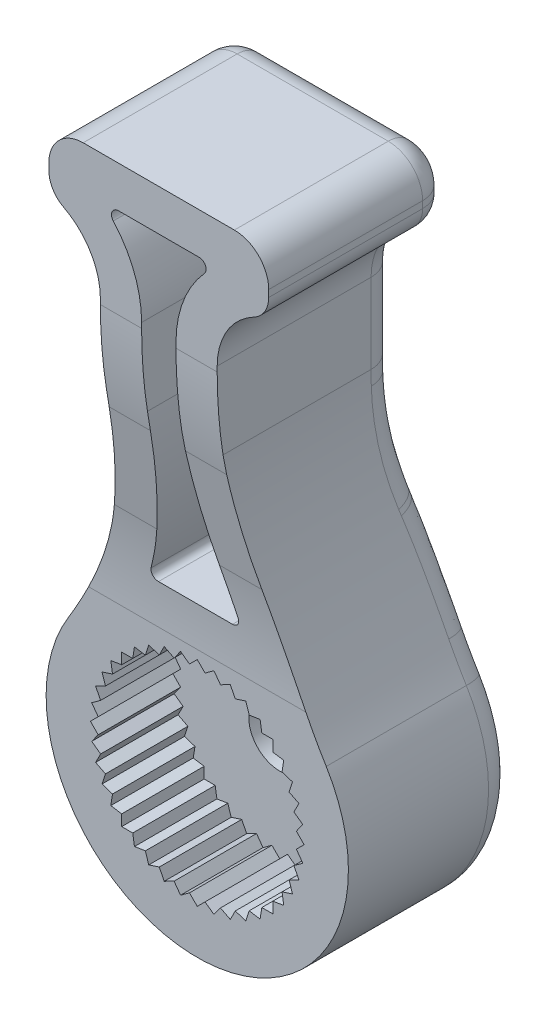
from build123d import *

# Parameters (mm, degrees)
BOSS_EXTRU_1_DEPTH                             = 15
ENL_V_MAT_EXTRU_1_DEPTH                        = 12.5
CONG_1_R                                       = 2
ENL_V_MAT_EXTRU_2_DEPTH                        = 6
ENL_V_MAT_EXTRU_3_DEPTH                        = 9.5
FRAISAGE_POUR_VIS_T_TE_FRAIS_E_M41_D           = 4.5
FRAISAGE_POUR_VIS_T_TE_FRAIS_E_M41_CSINK_D     = 7.4
FRAISAGE_POUR_VIS_T_TE_FRAIS_E_M41_CSINK_ANGLE = 90


with BuildPart() as part:
    # Esquisse1 → Boss.-Extru.1 (new body)
    with BuildSketch(Plane.XY):
        with BuildLine():
            Line((-5.5, 39), (5.5, 39))
            ThreePointArc((5.5, 39), (7.267766953, 38.267766953), (8, 36.5))
            Line((8, 36.5), (8, 36))
            ThreePointArc((8, 36), (7.711306936, 34.964901661), (6.928571429, 34.228629033))
            ThreePointArc((6.928571429, 34.228629033), (4.97173266, 32.387947464), (4.25, 29.800201616))
            Line((4.25, 29.800201616), (4.25, 23.988278388))
            ThreePointArc((4.25, 23.988278388), (5.55842416, 14.507892457), (9.385869565, 5.736327441))
            ThreePointArc((9.385869565, 5.736327441), (0, -11), (-9.385869565, 5.736327441))
            ThreePointArc((-9.385869565, 5.736327441), (-5.55842416, 14.507892457), (-4.25, 23.988278388))
            Line((-4.25, 23.988278388), (-4.25, 29.800201616))
            ThreePointArc((-4.25, 29.800201616), (-4.97173266, 32.387947464), (-6.928571429, 34.228629033))
            ThreePointArc((-6.928571429, 34.228629033), (-7.711306936, 34.964901661), (-8, 36))
            Line((-8, 36), (-8, 36.5))
            ThreePointArc((-8, 36.5), (-7.267766953, 38.267766953), (-5.5, 39))
        make_face()
    extrude(amount=BOSS_EXTRU_1_DEPTH)

    # Esquisse2 → Enlèv. mat.-Extru.1 (cut, symmetric)
    with BuildSketch(Plane(origin=(0, 0, 0), x_dir=(0, 0, -1), z_dir=(1, 0, 0))):
        with BuildLine():
            Line((-1.8, 39), (-1.8, 22.888888889))
            ThreePointArc((-1.8, 22.888888889), (-1.585930714, 19.023785476), (-0.946341463, 15.20596206))
            Line((-0.946341463, 15.20596206), (-0.853658537, 14.79403794))
            ThreePointArc((-0.853658537, 14.79403794), (-0.214069286, 10.976214524), (0, 7.111111111))
            Line((0, 7.111111111), (0, 5.736327441))
            Line((0, 5.736327441), (7.239623286, 8.413390474))
            Line((7.239623286, 8.413390474), (7.239623286, 39))
            Line((7.239623286, 39), (0, 39))
            Line((0, 39), (-1.8, 39))
        make_face()
        with BuildLine():
            Line((-12.2, -12.159132982), (-12.2, 8.413390474))
            ThreePointArc((-12.2, 8.413390474), (-12.366625309, 11.824549752), (-12.864914721, 15.203229859))
            Line((-12.864914721, 15.203229859), (-14.335085279, 22.637637159))
            ThreePointArc((-14.335085279, 22.637637159), (-14.833374691, 26.016317267), (-15, 29.427476544))
            Line((-15, 29.427476544), (-15, 29.800201616))
            Line((-15, 29.800201616), (-17.016089538, 29.800201616))
            Line((-17.016089538, 29.800201616), (-17.016089538, -12.159132982))
            Line((-17.016089538, -12.159132982), (-12.2, -12.159132982))
        make_face()
    extrude(amount=ENL_V_MAT_EXTRU_1_DEPTH, both=True, mode=Mode.SUBTRACT)

    # Congé1
    cong_1_edges = [part.edges().sort_by_distance(p)[0] for p in [
        (0, -11, 0),
        (8.979104822, 6.419188908, 0),
        (-8.979104822, 6.419188908, 0),
        (-4.254317965, 23.438515814, 1.8),
        (-4.608140366, 18.994125554, 1.582622356),
        (-5.423856389, 14.999840903, 0.899964203),
        (5.423856389, 14.999840903, 0.899964203),
        (4.608140366, 18.994125554, 1.582622355),
        (4.254317965, 23.438515814, 1.8),
        (4.25, 26.894240002, 1.8),
        (4.97173266, 32.387947464, 1.8),
        (7.711306936, 34.964901661, 1.8),
        (8, 36.25, 1.8),
        (7.267766953, 38.267766953, 1.8),
        (-7.267766953, 38.267766953, 1.8),
        (-8, 36.25, 1.8),
        (-7.711306936, 34.964901661, 1.8),
        (-4.97173266, 32.387947464, 1.8),
        (-4.25, 26.894240002, 1.8),
        (6.796676556, 10.881722866, 0.203700094),
        (-6.796676556, 10.881722866, 0.203700094),
        (0, 39, 1.8),
    ]]
    fillet(cong_1_edges, radius=CONG_1_R)

    # Esquisse3 → Enlèv. mat.-Extru.2 (cut)
    with BuildSketch(Plane.XY.offset(12.2)):
        Polygon((-4.571884004, 6.292831865), (-3.779220885, 6.167286361), (-3.531168427, 6.930713326), (-2.76790395, 6.682713664), (-2.403479141, 7.397937622), (-1.688407411, 7.033590377), (-1.216583598, 7.683000142), (-0.567312054, 7.211276753), (0.000292893, 7.7788817), (0.567777032, 7.211397562), (1.217186796, 7.683221374), (1.688910185, 7.033949829), (2.404134144, 7.398374638), (2.768481389, 6.683302908), (3.531908354, 6.931355365), (3.779908016, 6.168090888), (4.572739881, 6.293663119), (4.69844377, 5.5), (5.5, 5.5), (5.5, 4.697602154), (6.292687743, 4.57205275), (6.167165065, 3.779533753), (6.930453252, 3.531526388), (6.682498682, 2.768400688), (7.397592625, 2.404042125), (7.033311626, 1.689100409), (7.682603339, 1.217362366), (7.21096572, 0.568208873), (7.778467486, 0.000707107), (7.211086529, -0.566673851), (7.682824571, -1.215965564), (7.033671078, -1.687603184), (7.398029641, -2.402697128), (6.683087926, -2.766978127), (6.931095292, -3.530266314), (6.167969592, -3.778220885), (6.293518996, -4.570908627), (5.5, -4.696589689), (5.5, -5.5), (4.697431305, -5.5), (4.571908627, -6.292518997), (3.779220885, -6.166969592), (3.531266314, -6.930095292), (2.767978127, -6.682087926), (2.403697128, -7.397029641), (1.688603185, -7.032671078), (1.216965564, -7.681824571), (0.567673851, -7.210086529), (0.000292893, -7.777467486), (-0.567208873, -7.20996572), (-1.216362367, -7.68160334), (-1.68810041, -7.032311626), (-2.403042125, -7.396592625), (-2.767400688, -6.681498682), (-3.530526388, -6.929453252), (-3.778533753, -6.166165065), (-4.57105275, -6.291687743), (-4.69644377, -5.5), (-5.5, -5.5), (-5.5, -4.697285386), (-6.292663119, -4.571739881), (-6.167090888, -3.778908016), (-6.930355365, -3.530908354), (-6.682302908, -2.767481389), (-7.397374638, -2.403134144), (-7.032949829, -1.687910185), (-7.682221374, -1.216186796), (-7.210397562, -0.566777032), (-7.7778817, 0.000707107), (-7.210276753, 0.568312054), (-7.682000142, 1.217583598), (-7.032590377, 1.689407411), (-7.396937622, 2.404479141), (-6.681713664, 2.76890395), (-6.929713326, 3.532168427), (-6.166286361, 3.780220885), (-6.291831865, 4.572884004), (-5.5, 4.698297851), (-5.5, 5.5), (-4.697456235, 5.5), align=None)
    extrude(amount=-ENL_V_MAT_EXTRU_2_DEPTH, mode=Mode.SUBTRACT)

    # Esquisse4 → Enlèv. mat.-Extru.3 (cut)
    with BuildSketch(Plane.XY.offset(15)):
        with BuildLine():
            Line((2.944264644, 36), (-2.944264644, 36))
            ThreePointArc((-2.944264644, 36), (-3.401233532, 35.702927168), (-3.315190253, 35.164717742))
            ThreePointArc((-3.315190253, 35.164717742), (-1.784128384, 32.674355581), (-1.25, 29.800201616))
            Line((-1.25, 29.800201616), (-1.25, 23.988278388))
            ThreePointArc((-1.25, 23.988278388), (-1.72133749, 18.021747553), (-3.123657379, 12.203229859))
            ThreePointArc((-3.123657379, 12.203229859), (-3.145428928, 12.13669842), (-3.167323004, 12.0702072))
            ThreePointArc((-3.167323004, 12.0702072), (-3.09777209, 11.620481242), (-2.692550939, 11.413390474))
            Line((-2.692550939, 11.413390474), (2.692550939, 11.413390474))
            ThreePointArc((2.692550939, 11.413390474), (3.09777209, 11.620481242), (3.167323004, 12.0702072))
            ThreePointArc((3.167323004, 12.0702072), (3.145428928, 12.13669842), (3.123657379, 12.203229859))
            ThreePointArc((3.123657379, 12.203229859), (1.72133749, 18.021747553), (1.25, 23.988278388))
            Line((1.25, 23.988278388), (1.25, 29.800201616))
            ThreePointArc((1.25, 29.800201616), (1.784128384, 32.674355581), (3.315190253, 35.164717742))
            ThreePointArc((3.315190253, 35.164717742), (3.401233532, 35.702927168), (2.944264644, 36))
        make_face()
    extrude(amount=-ENL_V_MAT_EXTRU_3_DEPTH, mode=Mode.SUBTRACT)

    # Fraisage pour vis à tête fraisée M41 (through all)
    with Locations(Plane(origin=(0, 0, 0), x_dir=(-1, 0, 0), z_dir=(0, 0, -1))):
        with Locations((0, 0)):
            CounterSinkHole(FRAISAGE_POUR_VIS_T_TE_FRAIS_E_M41_D / 2, FRAISAGE_POUR_VIS_T_TE_FRAIS_E_M41_CSINK_D / 2, counter_sink_angle=FRAISAGE_POUR_VIS_T_TE_FRAIS_E_M41_CSINK_ANGLE)


solid = part.part
